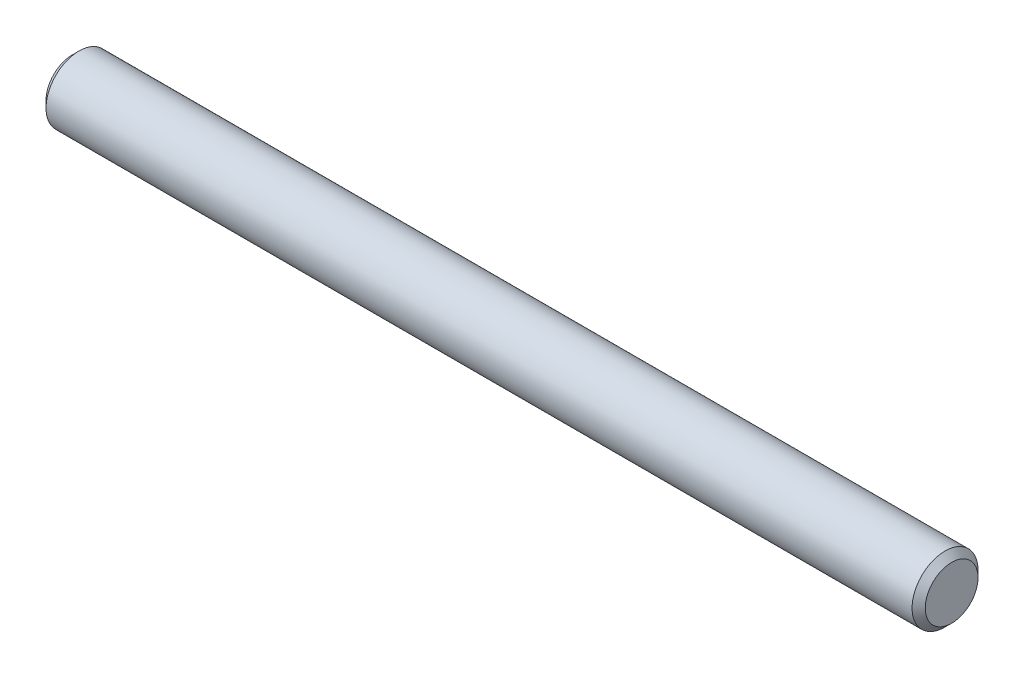
from build123d import *

# Parameters (mm, degrees)
EXTRUDE1_DEPTH      = 63.5
EXTRUDE1_DEPTH_BACK = 63.5
SKETCH2_R           = 4.7625
CHAMFER1_SIZE       = 0.9525


with BuildPart() as part:
    # Sketch2 → Extrude1 (new, two sides: drawn at the far end of the back side and taken through both)
    with BuildSketch(Plane(origin=(0, 0, 0), x_dir=(0, 0, -1), z_dir=(1, 0, 0)).offset(-EXTRUDE1_DEPTH_BACK)):
        Circle(SKETCH2_R)
    extrude(amount=EXTRUDE1_DEPTH + EXTRUDE1_DEPTH_BACK)

    # Chamfer1
    chamfer1_edges = [part.edges().sort_by_distance(p)[0] for p in [
        (-63.5, 0, 4.7625),
        (63.5, 0, 4.7625),
    ]]
    chamfer(chamfer1_edges, length=CHAMFER1_SIZE)


solid = part.part
